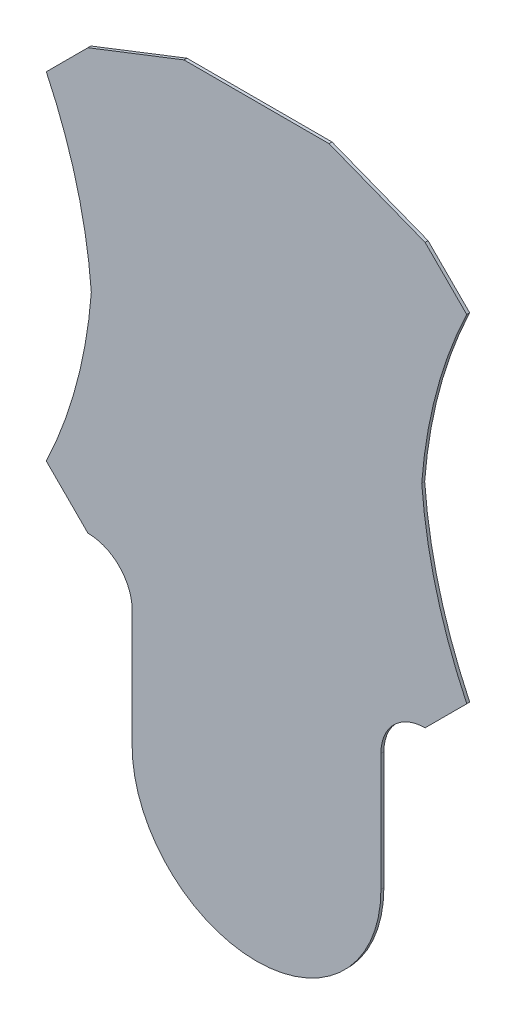
from build123d import *

# Parameters (mm, degrees)
BOSS_EXTRUDE1_DEPTH = 2


with BuildPart() as part:
    # Sketch1 → Boss-Extrude1 (new body)
    with BuildSketch(Plane.XY):
        with BuildLine():
            Line((-142.766074481, 114.481803233), (-114.481803233, 142.766074481))
            Line((-114.481803233, 142.766074481), (-49.267584828, 168.204347178))
            Line((-49.267584828, 168.204347178), (49.267584828, 168.204347178))
            Line((49.267584828, 168.204347178), (114.481803233, 142.766074481))
            Line((114.481803233, 142.766074481), (142.766074481, 114.481803233))
            ThreePointArc((142.766074481, 114.481803233), (122.165206788, 58.660093881), (112.192625845, 0))
            ThreePointArc((112.192625845, 0), (122.165206788, -58.660093881), (142.766074481, -114.481803233))
            Line((142.766074481, -114.481803233), (114.481803233, -142.766074481))
            ThreePointArc((114.481803233, -142.766074481), (93.268599798, -151.552871045), (84.481803233, -172.766074481))
            Line((84.481803233, -172.766074481), (84.481803233, -252.766074481))
            ThreePointArc((84.481803233, -252.766074481), (0, -337.247877714), (-84.481803233, -252.766074481))
            Line((-84.481803233, -252.766074481), (-84.481803233, -172.766074481))
            ThreePointArc((-84.481803233, -172.766074481), (-93.268599798, -151.552871045), (-114.481803233, -142.766074481))
            Line((-114.481803233, -142.766074481), (-142.766074481, -114.481803233))
            ThreePointArc((-142.766074481, -114.481803233), (-122.165206788, -58.660093881), (-112.192625845, 0))
            ThreePointArc((-112.192625845, 0), (-122.165206788, 58.660093881), (-142.766074481, 114.481803233))
        make_face()
    extrude(amount=BOSS_EXTRUDE1_DEPTH)


solid = part.part
